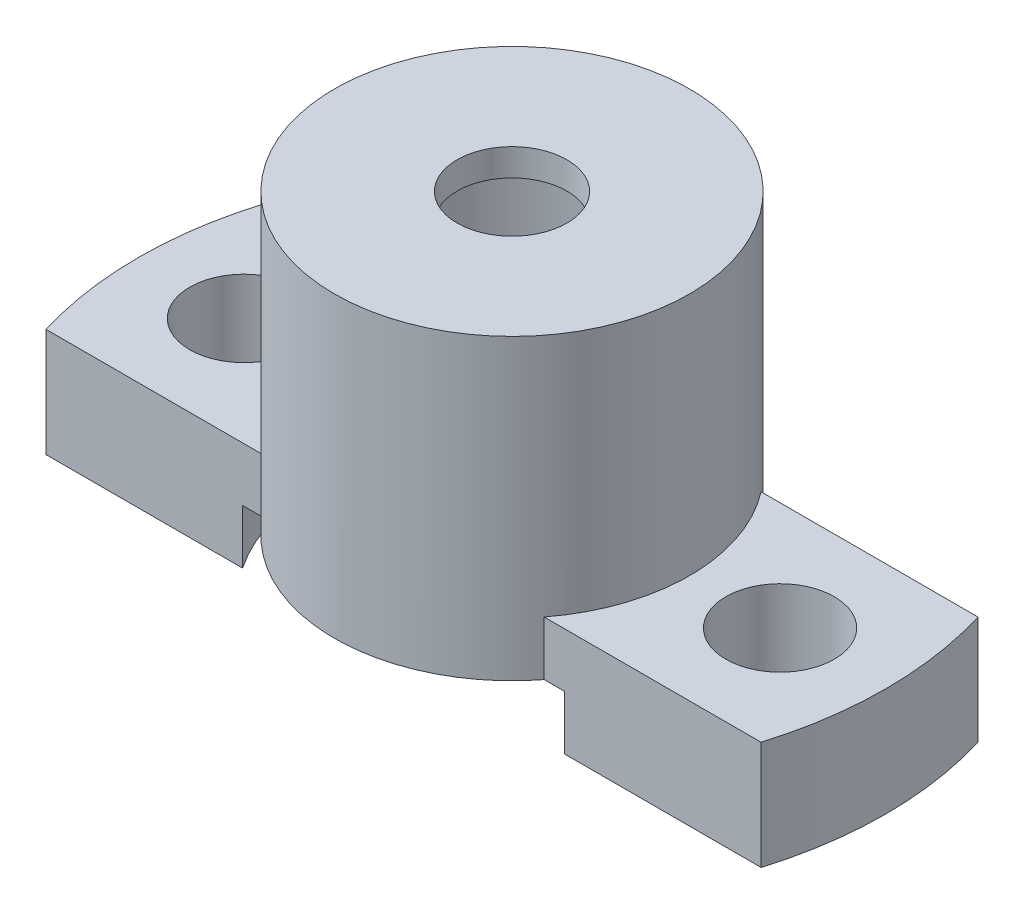
from build123d import *

# Parameters (mm, degrees)
SKETCH5_R                             = 6.55
SKETCH5_R_2                           = 2.025
EXT_TOPMAGNETROOM_DEPTH               = 1
EXT_MAGNETROOM_START                  = 4
SKETCH7_R                             = 6.55
SKETCH7_R_2                           = 5.05
EXT_MAGNETROOM_DEPTH                  = 4
BOTTOM_ARMS_FIXING_WITH_SUPPORT_DEPTH = 2
BOTTOM_START                          = 2
BOTTOM_FIXING_ARMS_END_DEPTH          = 2
ESQUISSE1_R                           = 2
EXT_HOLEMOUNTED_DEPTH                 = 16.773179512
SKETCH10_R                            = 6.55
SKETCH10_R_2                          = 5.05
CHAMBER_DEPTH                         = 5
SKETCH11_R                            = 6.55
SKETCH11_R_2                          = 2.025
BOSS_EXTRUDE4_DEPTH                   = 1
ESQUISSE3_R                           = 3
ENL_V_MAT_EXTRU_2_DEPTH               = 18.714208758
SKETCH13_R                            = 5.2
CUT_EXTRUDE2_DEPTH                    = 4


with BuildPart() as part:
    # Sketch5 → Ext_TopMagnetRoom (new body)
    with BuildSketch(Plane(origin=(0, 0, 0), x_dir=(-1, 0, 0), z_dir=(0, 1, 0))):
        with Locations(Location((0, 0, 0), (0, 0, 90))):
            Circle(SKETCH5_R)
        with Locations(Location((0, 0, 0), (0, 0, 90))):
            Circle(SKETCH5_R_2, mode=Mode.SUBTRACT)
    extrude(amount=EXT_TOPMAGNETROOM_DEPTH)

    # Sketch7 → Ext_MagnetRoom (add)
    with BuildSketch(Plane.XZ.offset(EXT_MAGNETROOM_START)):
        with Locations(Location((0, 0, 0), (0, 0, 270))):
            Circle(SKETCH7_R)
        with Locations(Location((0, 0, 0), (0, 0, 270))):
            Circle(SKETCH7_R_2, mode=Mode.SUBTRACT)
    extrude(amount=-EXT_MAGNETROOM_DEPTH)

    # Sketch6 → Bottom-arms fixing with support (add)
    with BuildSketch(Plane.XZ.offset(4)):
        with BuildLine():
            Line((13.186761996, -4), (5.186761996, -4))
            ThreePointArc((5.186761996, -4), (6.55, 0), (5.186761996, 4))
            Line((5.186761996, 4), (13.186761996, 4))
            ThreePointArc((13.186761996, 4), (13.780083161, 0), (13.186761996, -4))
        make_face()
        with BuildLine():
            Line((-13.186761996, -4), (-5.186761996, -4))
            ThreePointArc((-5.186761996, -4), (-6.55, 0), (-5.186761996, 4))
            Line((-5.186761996, 4), (-13.186761996, 4))
            ThreePointArc((-13.186761996, 4), (-13.780083161, 0), (-13.186761996, -4))
        make_face()
    extrude(amount=-BOTTOM_ARMS_FIXING_WITH_SUPPORT_DEPTH)

    # Sketch9 → Bottom- Fixing arms End (add)
    with BuildSketch(Plane.XZ.offset(4).offset(BOTTOM_START)):
        with BuildLine():
            Line((13.186761996, 4), (5.936761996, 4))
            ThreePointArc((5.936761996, 4), (7.158571296, 0), (5.936761996, -4))
            Line((5.936761996, -4), (13.186761996, -4))
            ThreePointArc((13.186761996, -4), (13.780083161, 0), (13.186761996, 4))
        make_face()
        with BuildLine():
            Line((-13.186761996, -4), (-5.936761996, -4))
            ThreePointArc((-5.936761996, -4), (-7.158571296, 0), (-5.936761996, 4))
            Line((-5.936761996, 4), (-13.186761996, 4))
            ThreePointArc((-13.186761996, 4), (-13.780083161, 0), (-13.186761996, -4))
        make_face()
    extrude(amount=-BOTTOM_FIXING_ARMS_END_DEPTH)

    # Esquisse1 → Ext_HoleMounted (cut, through all)
    with BuildSketch(Plane(origin=(0, -2, 0), x_dir=(1, 0, 0), z_dir=(0, 1, 0))):
        with Locations(Location((-9.886761996, 0, 0), (0, 0, 270))):
            Circle(ESQUISSE1_R)
        with Locations(Location((9.886761996, 0, 0), (0, 0, 270))):
            Circle(ESQUISSE1_R)
    extrude(amount=-EXT_HOLEMOUNTED_DEPTH, mode=Mode.SUBTRACT)

    # Sketch10 → chamber (add)
    with BuildSketch(Plane(origin=(0, 1, 0), x_dir=(1, 0, 0), z_dir=(0, 1, 0))):
        with Locations(Location((0, 0, 0), (0, 0, 142.360804213))):
            Circle(SKETCH10_R)
        with Locations(Location((0, 0, 0), (0, 0, 90))):
            Circle(SKETCH10_R_2, mode=Mode.SUBTRACT)
    extrude(amount=CHAMBER_DEPTH)

    # Sketch11 → Boss-Extrude4 (add)
    with BuildSketch(Plane(origin=(0, 6, 0), x_dir=(1, 0, 0), z_dir=(0, 1, 0))):
        with Locations(Location((0, 0, 0), (0, 0, 142.360804213))):
            Circle(SKETCH11_R)
        with Locations(Location((0, 0, 0), (0, 0, 270))):
            Circle(SKETCH11_R_2, mode=Mode.SUBTRACT)
    extrude(amount=BOSS_EXTRUDE4_DEPTH)

    # Esquisse3 → Enlèv. mat.-Extru.2 (cut, through all)
    with BuildSketch(Plane(origin=(0, -2, 0), x_dir=(1, 0, 0), z_dir=(0, 1, 0))):
        with Locations((9.886761996, 0)):
            Circle(ESQUISSE3_R)
        with Locations((-9.886761996, 0)):
            Circle(ESQUISSE3_R)
    extrude(amount=ENL_V_MAT_EXTRU_2_DEPTH, mode=Mode.SUBTRACT)

    # Sketch13 → Cut-Extrude2 (cut)
    with BuildSketch(Plane.XZ.offset(4)):
        with Locations(Location((0, 0, 0), (0, 0, 270))):
            Circle(SKETCH13_R)
    extrude(amount=-CUT_EXTRUDE2_DEPTH, mode=Mode.SUBTRACT)


solid = part.part
